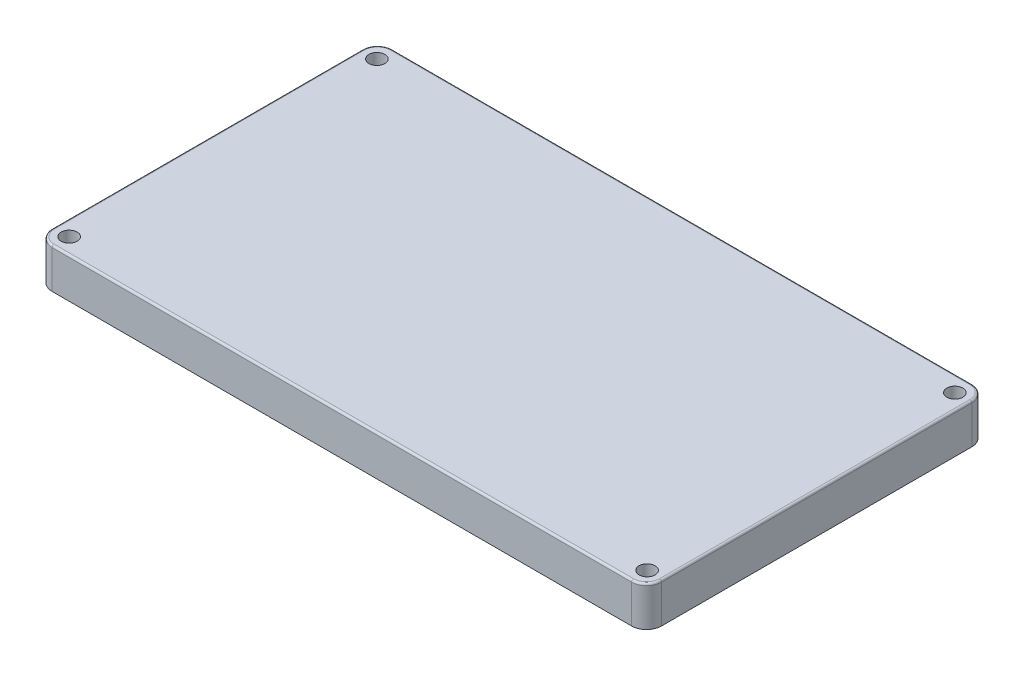
from build123d import *

# Parameters (mm, degrees)
SKETCH1_W           = 304.8
SKETCH1_H           = 170.18
BOSS_EXTRUDE1_DEPTH = 20
HOLE1_D             = 8
FILLET1_R           = 7.5
FILLET2_R           = 1


with BuildPart() as part:
    # Sketch1 → Boss-Extrude1 (new body)
    with BuildSketch(Plane(origin=(0, -62.552068535, 0), x_dir=(1, 0, 0), z_dir=(0, 1, 0))):
        with Locations((152.4, 85.09)):
            Rectangle(SKETCH1_W, SKETCH1_H)
    extrude(amount=-BOSS_EXTRUDE1_DEPTH)

    # Hole1 (through all)
    with Locations(Plane(origin=(0, -62.552068535, 0), x_dir=(1, 0, 0), z_dir=(0, 1, 0))):
        with Locations((8, 8), (297.052, 8), (8, 161.924), (297.052, 161.924)):
            Hole(HOLE1_D / 2)

    # Fillet1
    fillet1_edges = [part.edges().sort_by_distance(p)[0] for p in [
        (304.8, -72.552068535, -170.18),
        (304.8, -72.552068535, 0),
        (0, -72.552068535, -170.18),
        (0, -72.552068535, 0),
    ]]
    fillet(fillet1_edges, radius=FILLET1_R)

    # Fillet2
    fillet2_edges = [part.edges().sort_by_distance(p)[0] for p in [
        (2.196699141, -62.552068535, -167.983300859),
        (0, -62.552068535, -85.09),
        (152.4, -62.552068535, -170.18),
        (2.196699141, -62.552068535, -2.196699141),
        (302.603300859, -62.552068535, -167.983300859),
        (152.4, -62.552068535, 0),
        (304.8, -62.552068535, -85.09),
        (302.603300859, -62.552068535, -2.196699141),
    ]]
    fillet(fillet2_edges, radius=FILLET2_R)


solid = part.part
